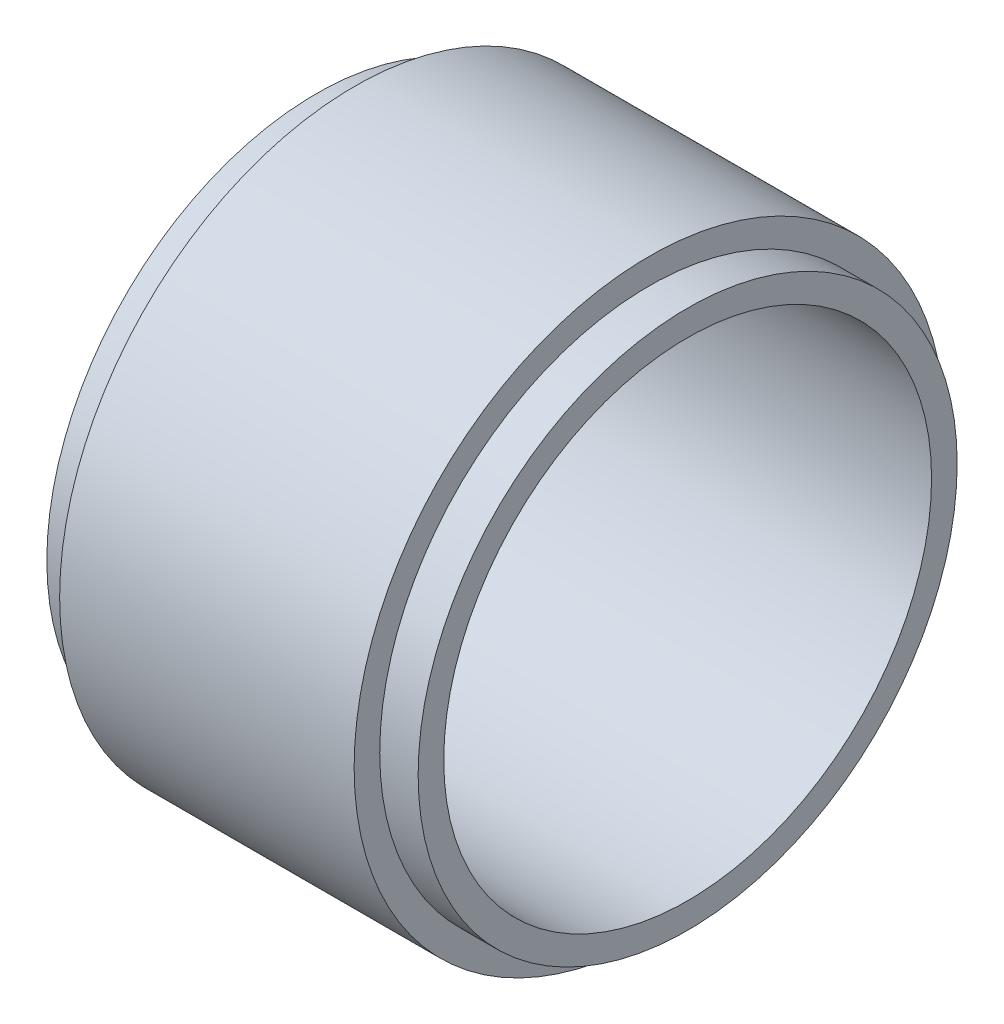
from build123d import *


with BuildPart() as part:
    # Sketch2 → Revolve2 (revolve)
    with BuildSketch(Plane.XY, mode=Mode.PRIVATE) as revolve2_sk:
        Polygon((0, 21.05), (-3, 21.05), (-3, 23.05), (-26, 23.05), (-26, 21.05), (-29, 21.05), (-29, 19.05), (0, 19.05), align=None)
    revolve(revolve2_sk.sketch.rotate(Axis((0, 0, 0), (-1, 0, 0)), 90), axis=Axis((0, 0, 0), (-1, 0, 0)))


solid = part.part
